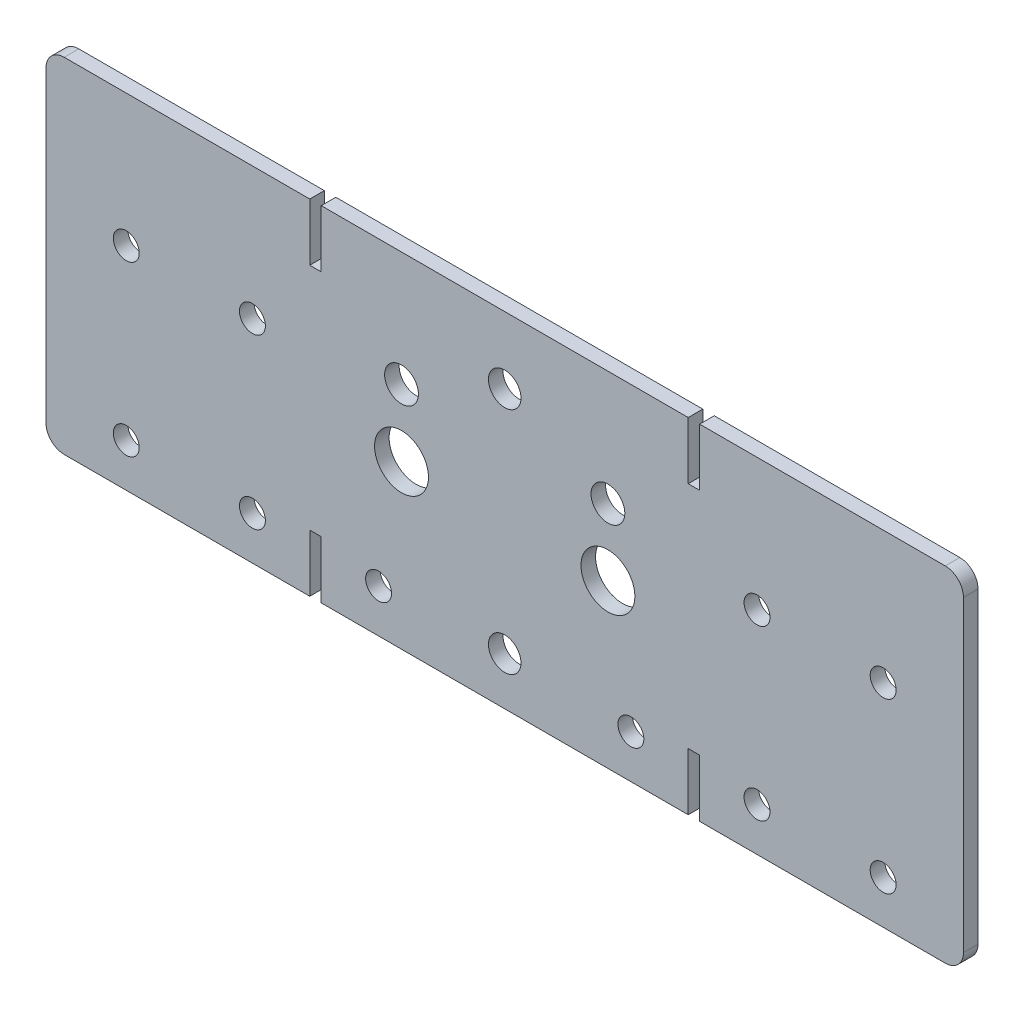
from build123d import *

# Parameters (mm, degrees)
SKETCH1_R           = 1.1303
SKETCH1_R_2         = 2.3495
SKETCH1_R_3         = 1.4732
SKETCH1_R_4         = 1.42
BOSS_EXTRUDE1_DEPTH = 1.27
FILLET1_R           = 1.5875


with BuildPart() as part:
    # Sketch1 → Boss-Extrude1 (new body)
    with BuildSketch(Plane.XY):
        Polygon((23, 0), (0, 0), (0, -30), (23, -30), (23, -25), (24, -25), (24, -30), (56, -30), (56, -25), (57, -25), (57, -30), (80, -30), (80, 0), (57, 0), (57, -5), (56, -5), (56, 0), (24, 0), (24, -5), (23, -5), align=None)
        with Locations((7, -26.225)):
            Circle(SKETCH1_R, mode=Mode.SUBTRACT)
        with Locations((18, -26.225)):
            Circle(SKETCH1_R, mode=Mode.SUBTRACT)
        with Locations((29, -26.225)):
            Circle(SKETCH1_R, mode=Mode.SUBTRACT)
        with Locations((31, -15.832468656)):
            Circle(SKETCH1_R_2, mode=Mode.SUBTRACT)
        with Locations((51, -26.225)):
            Circle(SKETCH1_R, mode=Mode.SUBTRACT)
        with Locations((62, -26.225)):
            Circle(SKETCH1_R, mode=Mode.SUBTRACT)
        with Locations((73, -26.225)):
            Circle(SKETCH1_R, mode=Mode.SUBTRACT)
        with Locations((49, -15.832468656)):
            Circle(SKETCH1_R_2, mode=Mode.SUBTRACT)
        with Locations((7, -11.525)):
            Circle(SKETCH1_R, mode=Mode.SUBTRACT)
        with Locations((18, -11.525)):
            Circle(SKETCH1_R, mode=Mode.SUBTRACT)
        with Locations((31, -10)):
            Circle(SKETCH1_R_3, mode=Mode.SUBTRACT)
        with Locations((49, -10)):
            Circle(SKETCH1_R_3, mode=Mode.SUBTRACT)
        with Locations((62, -11.525)):
            Circle(SKETCH1_R, mode=Mode.SUBTRACT)
        with Locations((73, -11.525)):
            Circle(SKETCH1_R, mode=Mode.SUBTRACT)
        with Locations((40, -5.832468656)):
            Circle(SKETCH1_R_4, mode=Mode.SUBTRACT)
        with Locations((40, -25.832468656)):
            Circle(SKETCH1_R_4, mode=Mode.SUBTRACT)
    extrude(amount=BOSS_EXTRUDE1_DEPTH)

    # Fillet1
    fillet1_edges = [part.edges().sort_by_distance(p)[0] for p in [
        (0, -30, 0.635),
        (0, 0, 0.635),
        (80, 0, 0.635),
        (80, -30, 0.635),
    ]]
    fillet(fillet1_edges, radius=FILLET1_R)


solid = part.part
